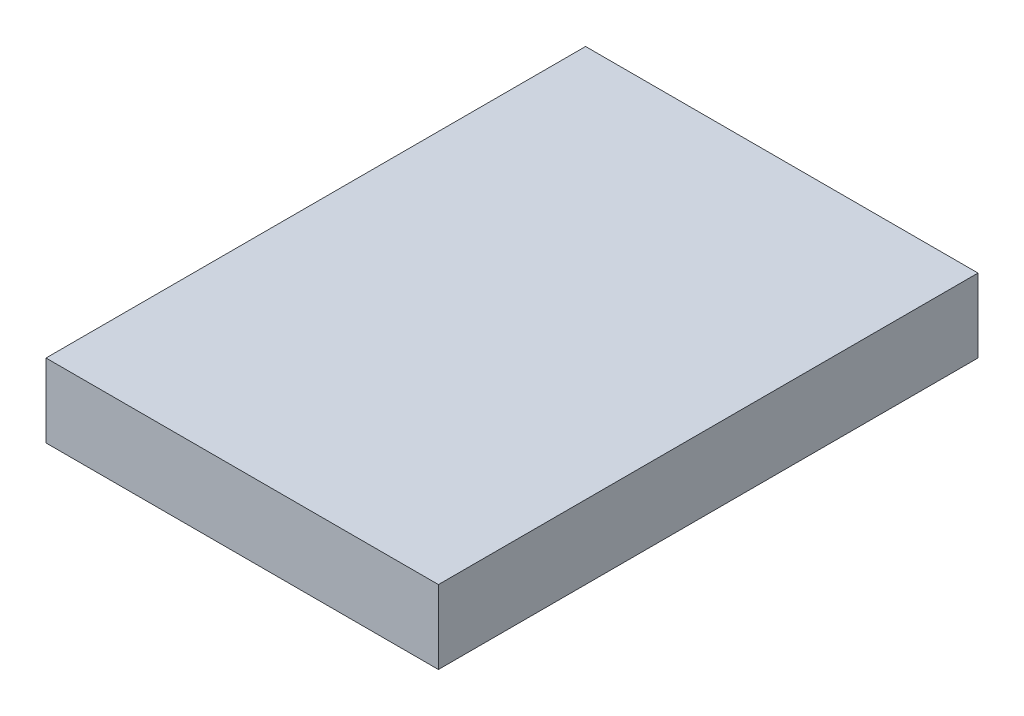
from build123d import *

# Parameters (mm, degrees)
SKETCH1_W           = 101.6
SKETCH1_H           = 139.7
BOSS_EXTRUDE1_DEPTH = 19.05


with BuildPart() as part:
    # Sketch1 → Boss-Extrude1 (new body)
    with BuildSketch(Plane(origin=(0, 0, 0), x_dir=(1, 0, 0), z_dir=(0, 1, 0))):
        Rectangle(SKETCH1_W, SKETCH1_H)
    extrude(amount=-BOSS_EXTRUDE1_DEPTH)


solid = part.part
